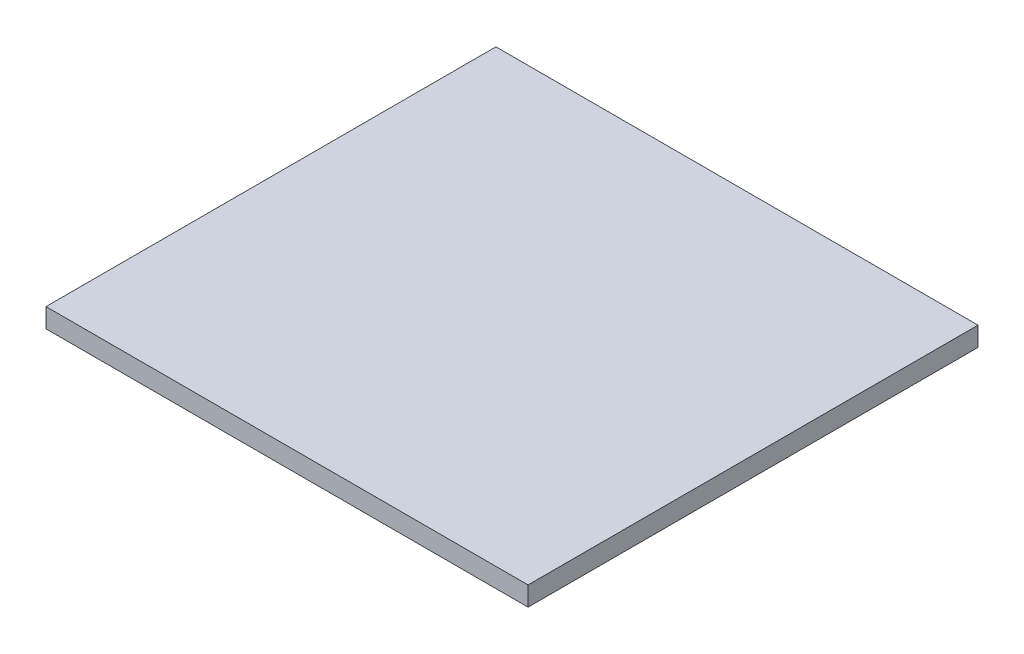
from build123d import *

# Parameters (mm, degrees)
SKETCH1_W           = 150
SKETCH1_H           = 140
BOSS_EXTRUDE1_DEPTH = 6


with BuildPart() as part:
    # Sketch1 → Boss-Extrude1 (new body)
    with BuildSketch(Plane(origin=(0, 0, 0), x_dir=(1, 0, 0), z_dir=(0, 1, 0))):
        Rectangle(SKETCH1_W, SKETCH1_H)
    extrude(amount=BOSS_EXTRUDE1_DEPTH)


solid = part.part
